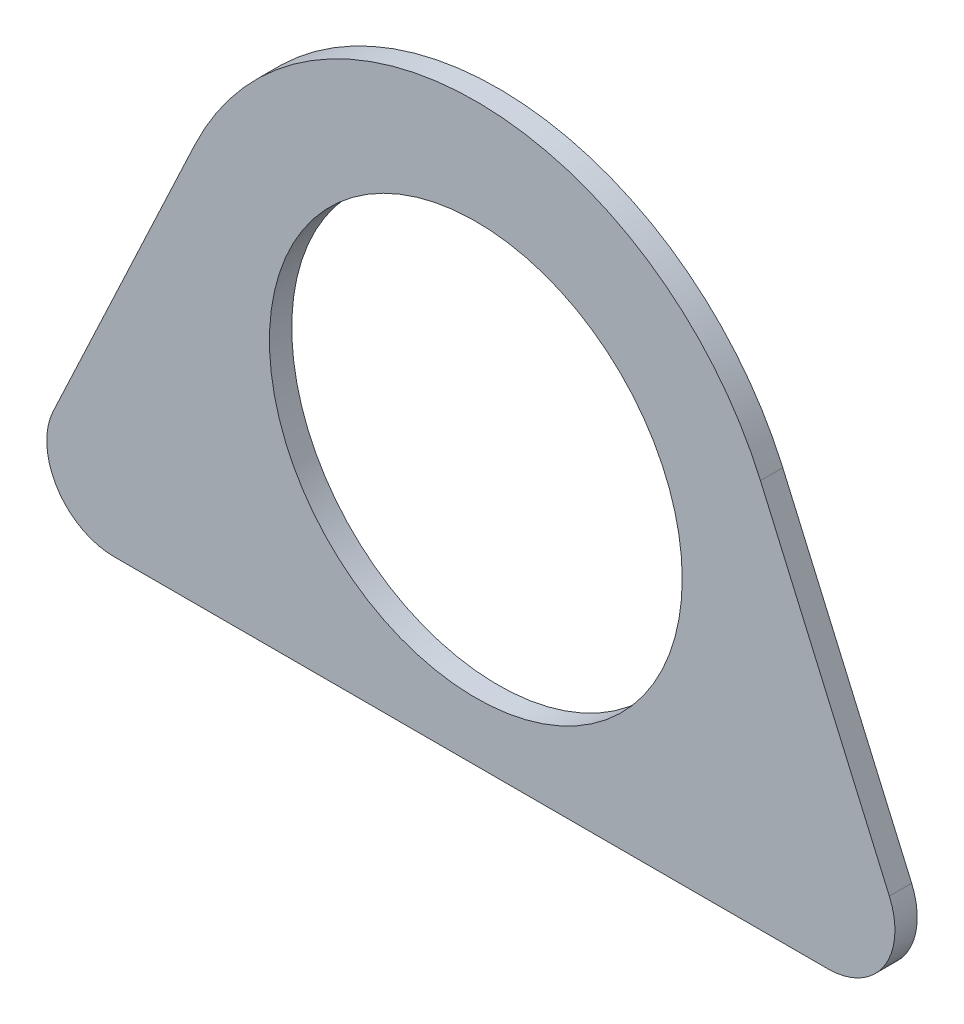
from build123d import *

# Parameters (mm, degrees)
SKETCH1_R           = 27.75
BOSS_EXTRUDE1_DEPTH = 3


with BuildPart() as part:
    # Sketch1 → Boss-Extrude1 (new body)
    with BuildSketch(Plane.XY.offset(162)):
        with BuildLine():
            Line((-45.305021967, 70), (-20, 70))
            Line((-20, 70), (20, 70))
            Line((20, 70), (45.305021967, 70))
            Line((45.305021967, 70), (49.846930848, 70))
            ThreePointArc((49.846930848, 70), (57.376653748, 74.070165008), (58.0958845, 82.599272656))
            Line((58.0958845, 82.599272656), (40.765979439, 122.316625933))
            ThreePointArc((40.765979439, 122.316625933), (3.077668906, 147.366003385), (-35.28933022, 123.36905692))
            Line((-35.28933022, 123.36905692), (-54.331701831, 82.826144007))
            ThreePointArc((-54.331701831, 82.826144007), (-53.782712085, 74.174821043), (-46.185498909, 70))
            Line((-46.185498909, 70), (-45.305021967, 70))
        make_face()
        with Locations((2.5, 105.61875)):
            Circle(SKETCH1_R, mode=Mode.SUBTRACT)
    extrude(amount=BOSS_EXTRUDE1_DEPTH)


solid = part.part
